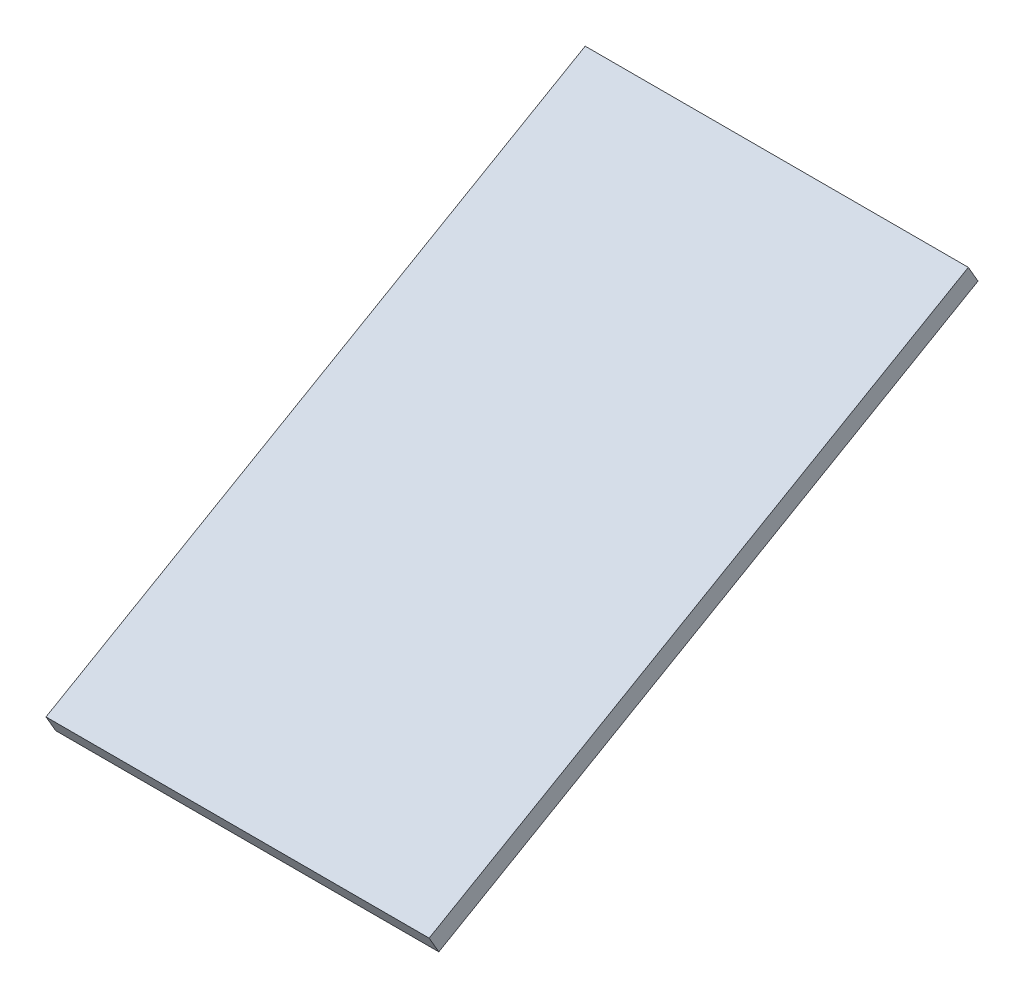
from build123d import *

# Parameters (mm, degrees)
BOSS_EXTRUDE1_DEPTH = 1016


with BuildPart() as part:
    # Sketch1 → Boss-Extrude1 (new body)
    with BuildSketch(Plane(origin=(0, 0, 0), x_dir=(0, 0, -1), z_dir=(1, 0, 0))):
        Polygon((0, 0), (1429.807941648, 825.5), (1404.157586241, 869.927718798), (-25.650355407, 44.427718798), align=None)
    extrude(amount=BOSS_EXTRUDE1_DEPTH)


solid = part.part
